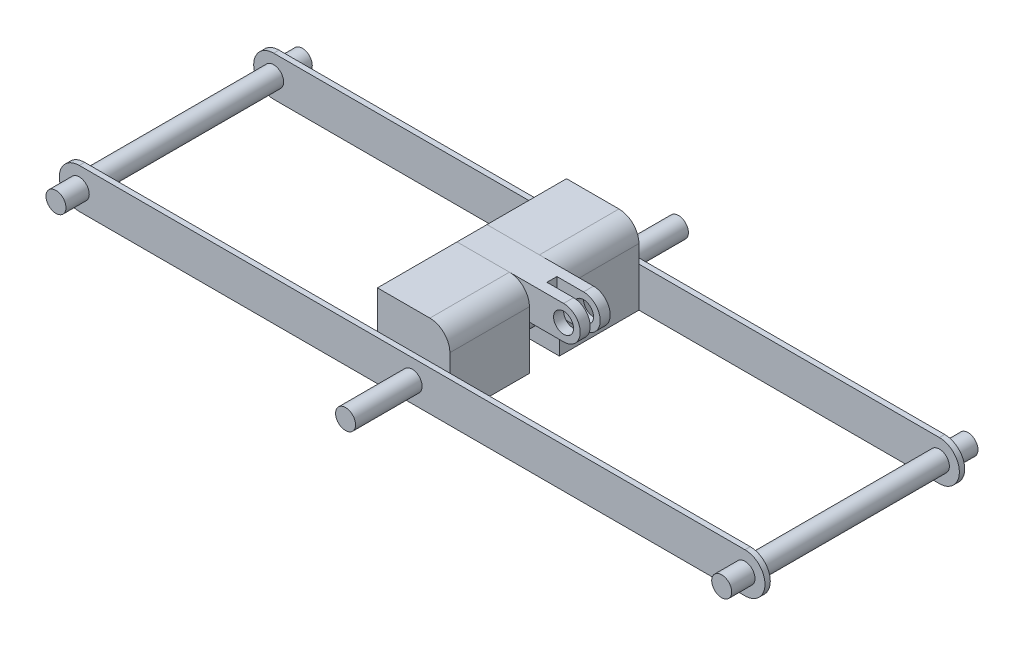
from build123d import *

# Parameters (mm, degrees)
SKETCH_1_R          = 15
EXTRUDE_1_DEPTH     = 185
EXTRUDE_1_2_DEPTH   = 185
EXTRUDE_2_DEPTH     = 8
SKETCH_3_R          = 15
EXTRUDE_3_DEPTH     = 250
SKETCH_5_R          = 15
EXTRUDE_4_DEPTH     = 22.5
SKETCH_6_W          = 108.750714941
SKETCH_6_H          = 116.693894846
EXTRUDE_5_DEPTH     = 119.5
FILLET_1_R          = 30
FILLET_2_R          = 30
CUT_EXTRUDE_2_DEPTH = 7.5
SCALE_1_SCALE       = 0.6


with BuildPart() as part:
    # 草图1 → 凸台-拉伸1 (new, symmetric)
    with BuildSketch(Plane.XY):
        Circle(SKETCH_1_R)
    extrude(amount=EXTRUDE_1_DEPTH, both=True)


with BuildPart() as body_2:
    # 草图1 → Extrude 1 2 (new, symmetric)
    with BuildSketch(Plane.XY):
        with Locations((1000, 0)):
            Circle(SKETCH_1_R)
    extrude(amount=EXTRUDE_1_2_DEPTH, both=True)


with BuildPart() as body_3:
    # 草图2 → 凸台-拉伸2 (new body)
    with BuildSketch(Plane.XY.offset(150)):
        with BuildLine():
            Line((0, 30), (1000, 30))
            ThreePointArc((1000, 30), (1030, 0), (1000, -30))
            Line((1000, -30), (0, -30))
            ThreePointArc((0, -30), (-30, 0), (0, 30))
        make_face()
    extrude(amount=-EXTRUDE_2_DEPTH)


with BuildPart() as body_4:
    # 镜向1: mirrored copy
    add(body_3.part.mirror(Plane.XY))


with BuildPart() as body_3_1:
    add(body_3.part)

    add(body_4.part)  # 凸台-拉伸3 merges body 4
    # 草图3 → 凸台-拉伸3 (add, symmetric)
    with BuildSketch(Plane.XY):
        with Locations(Location((500, 0, 0), (0, 0, 180))):
            Circle(SKETCH_3_R)
    extrude(amount=EXTRUDE_3_DEPTH, both=True)


with BuildPart() as body_4_2:
    # 草图5 → 凸台-拉伸4 (new, symmetric)
    with BuildSketch(Plane.XY):
        with BuildLine():
            Line((600, 86.693894846), (439.920801344, 86.693894846))
            Line((439.920801344, 86.693894846), (439.920801344, 36.693894846))
            Line((439.920801344, 36.693894846), (600, 36.693894846))
            ThreePointArc((600, 36.693894846), (625, 61.693894846), (600, 86.693894846))
        make_face()
        with Locations(Location((600, 61.693894846, 0), (0, 0, 180))):
            Circle(SKETCH_5_R, mode=Mode.SUBTRACT)
    extrude(amount=EXTRUDE_4_DEPTH, both=True)

    # 草图9 → 切除-拉伸2 (cut, symmetric)
    with BuildSketch(Plane.XY):
        Polygon((600, 86.693894846), (630.258181454, 86.693894846), (630.258181454, 36.693894846), (600, 36.693894846), (559.990536036, 36.693894846), (559.990536036, 86.693894846), align=None)
    extrude(amount=CUT_EXTRUDE_2_DEPTH, both=True, mode=Mode.SUBTRACT)


with BuildPart() as body_5:
    # 草图6 → 凸台-拉伸5 (new body)
    with BuildSketch(Plane.XY.offset(-142)):
        with Locations((494.296158815, 28.346947423)):
            Rectangle(SKETCH_6_W, SKETCH_6_H)
    extrude(amount=EXTRUDE_5_DEPTH)


with BuildPart() as body_6:
    # 镜向2: mirrored copy
    add(body_5.part.mirror(Plane.XY))

    # 圆角2
    fillet_2_edges = [body_6.edges().sort_by_distance(p)[0] for p in [
        (548.671516285, 86.693894846, 82.25),
    ]]
    fillet(fillet_2_edges, radius=FILLET_2_R)


with BuildPart() as body_5_1:
    add(body_5.part)

    # 圆角1
    fillet_1_edges = [body_5_1.edges().sort_by_distance(p)[0] for p in [
        (548.671516285, 86.693894846, -82.25),
    ]]
    fillet(fillet_1_edges, radius=FILLET_1_R)


with BuildPart() as part_1:
    # 缩放比例1: scaled about (0, 0, 0)
    add(part.part.scale(SCALE_1_SCALE))


with BuildPart() as body_2_1:
    # 缩放比例1: scaled about (0, 0, 0)
    add(body_2.part.scale(SCALE_1_SCALE))


with BuildPart() as body_3_2:
    # 缩放比例1: scaled about (0, 0, 0)
    add(body_3_1.part.scale(SCALE_1_SCALE))


with BuildPart() as body_5_2:
    # 缩放比例1: scaled about (0, 0, 0)
    add(body_5_1.part.scale(SCALE_1_SCALE))


with BuildPart() as body_6_1:
    # 缩放比例1: scaled about (0, 0, 0)
    add(body_6.part.scale(SCALE_1_SCALE))


with BuildPart() as body_4_2_1:
    # 缩放比例1: scaled about (0, 0, 0)
    add(body_4_2.part.scale(SCALE_1_SCALE))


solid = Compound([part_1.part, body_2_1.part, body_3_2.part, body_5_2.part, body_6_1.part, body_4_2_1.part])
